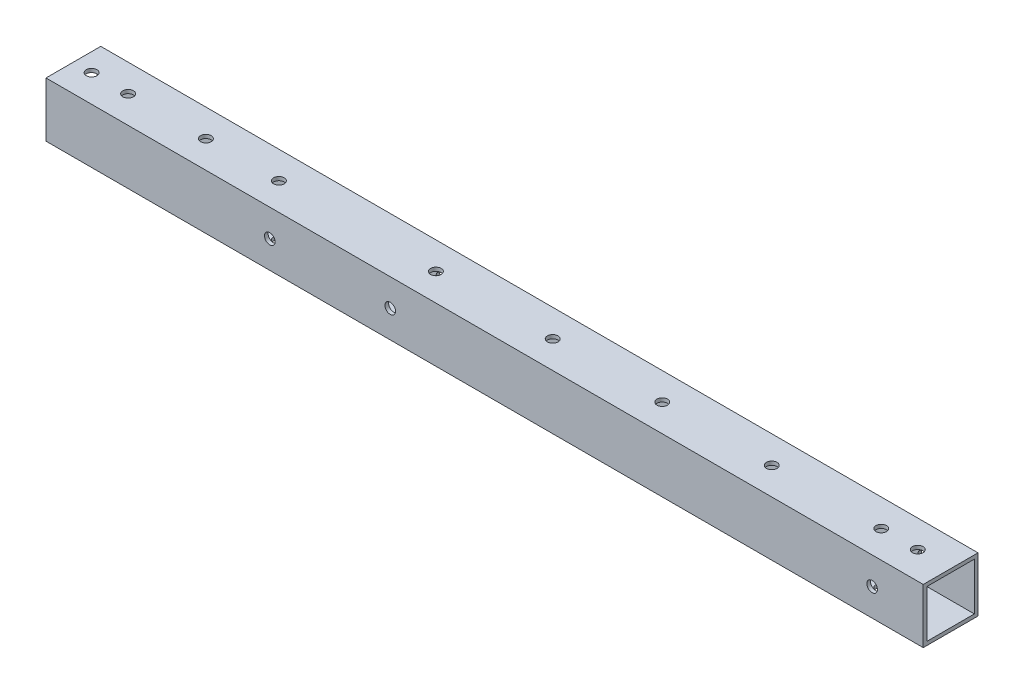
from build123d import *

# Parameters (mm, degrees)
SKETCH_1_W          = 15
SKETCH_1_H          = 15
SKETCH_1_W_2        = 13
SKETCH_1_H_2        = 13
EXTRUDE_1_DEPTH     = 240.3
SKETCH_2_R          = 1.45
CUT_EXTRUDE_1_DEPTH = 241.884495142
SKETCH_3_R          = 1.45
CUT_EXTRUDE_2_DEPTH = 241.884495142


with BuildPart() as part:
    # 草图1 → 凸台-拉伸1 (new body)
    with BuildSketch(Plane(origin=(0, 0, 0), x_dir=(0, 0, -1), z_dir=(1, 0, 0))):
        Rectangle(SKETCH_1_W, SKETCH_1_H)
        Rectangle(SKETCH_1_W_2, SKETCH_1_H_2, mode=Mode.SUBTRACT)
    extrude(amount=EXTRUDE_1_DEPTH)

    # 草图2 → 切除-拉伸1 (cut, through all)
    with BuildSketch(Plane(origin=(0, 7.5, 0), x_dir=(1, 0, 0), z_dir=(0, 1, 0))):
        with Locations(Location((5, 0, 0), (0, 0, 270))):
            Circle(SKETCH_2_R)
        with Locations(Location((15, 0, 0), (0, 0, 270))):
            Circle(SKETCH_2_R)
        with Locations(Location((36.30151519, 0, 0), (0, 0, 270))):
            Circle(SKETCH_2_R)
        with Locations(Location((56.30151519, 0, 0), (0, 0, 270))):
            Circle(SKETCH_2_R)
        with Locations(Location((99.30151519, 0, 0), (0, 0, 270))):
            Circle(SKETCH_2_R)
        with Locations(Location((221.30151519, 0, 0), (0, 0, 270))):
            Circle(SKETCH_2_R)
        with Locations(Location((231.30151519, 0, 0), (0, 0, 270))):
            Circle(SKETCH_2_R)
        with Locations(Location((131.30151519, 0, 0), (0, 0, 270))):
            Circle(SKETCH_2_R)
        with Locations(Location((161.30151519, 0, 0), (0, 0, 270))):
            Circle(SKETCH_2_R)
        with Locations(Location((191.30151519, 0, 0), (0, 0, 270))):
            Circle(SKETCH_2_R)
    extrude(amount=-CUT_EXTRUDE_1_DEPTH, mode=Mode.SUBTRACT)

    # 草图3 → 切除-拉伸2 (cut, through all)
    with BuildSketch(Plane.XY.offset(7.5)):
        with Locations((61.30151519, 0)):
            Circle(SKETCH_3_R)
        with Locations((226.30151519, 0)):
            Circle(SKETCH_3_R)
        with Locations((94.30151519, 0)):
            Circle(SKETCH_3_R)
    extrude(amount=-CUT_EXTRUDE_2_DEPTH, mode=Mode.SUBTRACT)


solid = part.part
